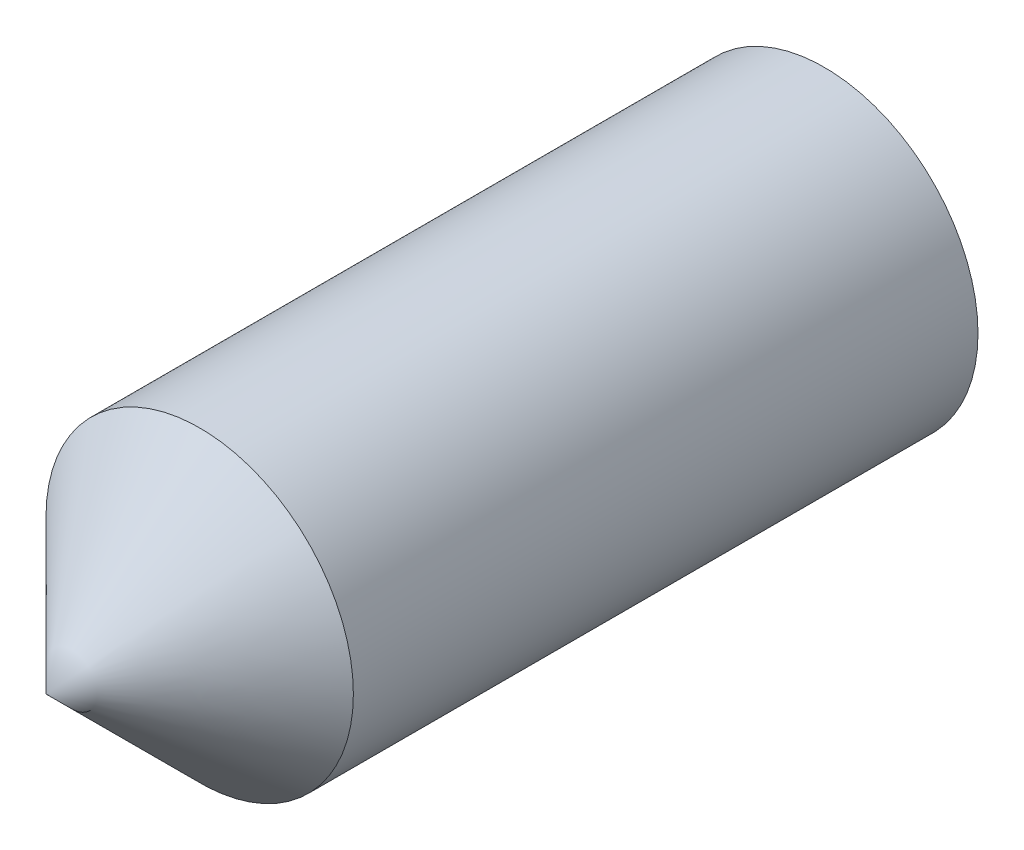
from build123d import *


with BuildPart() as part:
    # Sketch4 → Revolve1 (revolve)
    with BuildSketch(Plane(origin=(0, 33.5, 0), x_dir=(1, 0, 0), z_dir=(0, 1, 0)), mode=Mode.PRIVATE) as revolve1_sk:
        Polygon((0, -40), (9.842282851, -40), (9.842282851, -80.000046969), (0, -89.84232982), (0, -80.000046969), align=None)
    revolve(revolve1_sk.sketch.rotate(Axis((0, 33.5, 40), (0, 0, 1)), 180), axis=Axis((0, 33.5, 40), (0, 0, 1)))


solid = part.part
